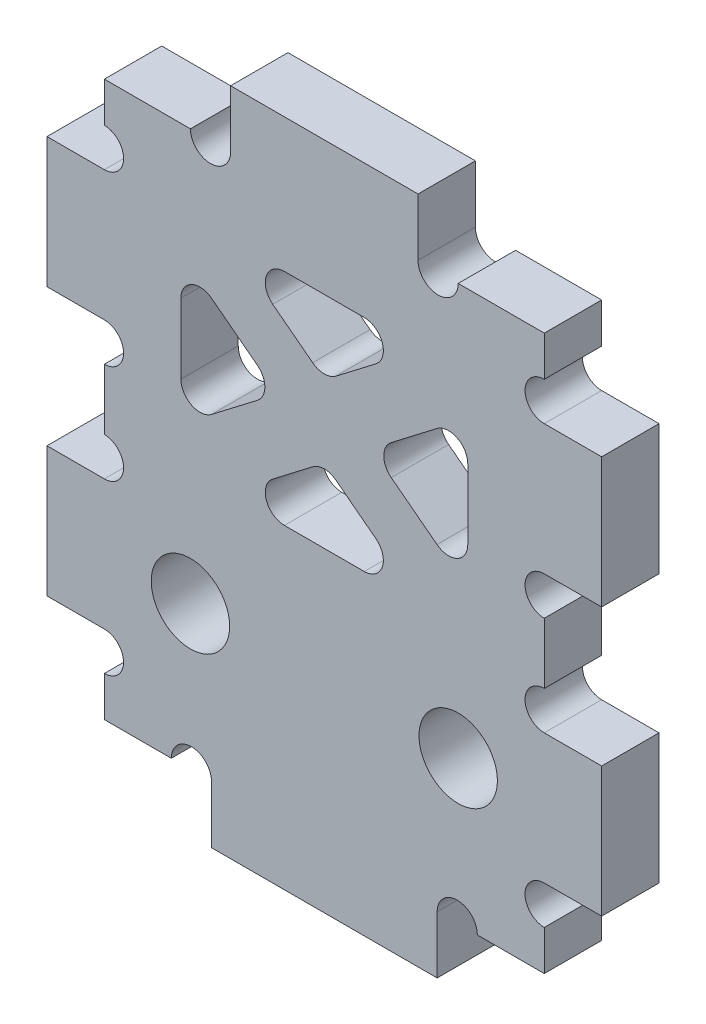
from build123d import *

# Parameters (mm, degrees)
SKETCH_1_R      = 2.05
EXTRUDE_1_DEPTH = 3
FILLET_1_R      = 1


with BuildPart() as part:
    # 草图1 → 凸台-拉伸1 (new body)
    with BuildSketch(Plane.XY):
        with BuildLine():
            Line((8, -14.5), (11.5, -14.5))
            Line((11.5, -14.5), (11.5, -12.41))
            ThreePointArc((11.5, -12.41), (10.495, -11.405), (11.5, -10.4))
            Line((11.5, -10.4), (14.5, -10.4))
            Line((14.5, -10.4), (14.5, -3.6))
            Line((14.5, -3.6), (11.5, -3.6))
            ThreePointArc((11.5, -3.6), (10.495, -2.595), (11.5, -1.59))
            Line((11.5, -1.59), (11.5, 1.59))
            ThreePointArc((11.5, 1.59), (10.495, 2.595), (11.5, 3.6))
            Line((11.5, 3.6), (14.5, 3.6))
            Line((14.5, 3.6), (14.5, 10.4))
            Line((14.5, 10.4), (11.5, 10.4))
            ThreePointArc((11.5, 10.4), (10.495, 11.405), (11.5, 12.41))
            Line((11.5, 12.41), (11.5, 14.5))
            Line((11.5, 14.5), (7, 14.5))
            ThreePointArc((7, 14.5), (5.95, 13.45), (4.9, 14.5))
            Line((4.9, 14.5), (4.9, 17.5))
            Line((4.9, 17.5), (-4.9, 17.5))
            Line((-4.9, 17.5), (-4.9, 14.5))
            ThreePointArc((-4.9, 14.5), (-5.95, 13.45), (-7, 14.5))
            Line((-7, 14.5), (-11.5, 14.5))
            Line((-11.5, 14.5), (-11.5, 12.41))
            ThreePointArc((-11.5, 12.41), (-10.789357685, 12.115642315), (-10.495, 11.405))
            ThreePointArc((-10.495, 11.405), (-10.789357685, 10.694357685), (-11.5, 10.4))
            Line((-11.5, 10.4), (-14.5, 10.4))
            Line((-14.5, 10.4), (-14.5, 3.6))
            Line((-14.5, 3.6), (-11.5, 3.6))
            ThreePointArc((-11.5, 3.6), (-10.789357685, 3.305642315), (-10.495, 2.595))
            ThreePointArc((-10.495, 2.595), (-10.789357685, 1.884357685), (-11.5, 1.59))
            Line((-11.5, 1.59), (-11.5, -1.59))
            ThreePointArc((-11.5, -1.59), (-10.789357685, -1.884357685), (-10.495, -2.595))
            ThreePointArc((-10.495, -2.595), (-10.789357685, -3.305642315), (-11.5, -3.6))
            Line((-11.5, -3.6), (-14.5, -3.6))
            Line((-14.5, -3.6), (-14.5, -10.4))
            Line((-14.5, -10.4), (-11.5, -10.4))
            ThreePointArc((-11.5, -10.4), (-10.789357685, -10.694357685), (-10.495, -11.405))
            ThreePointArc((-10.495, -11.405), (-10.789357685, -12.115642315), (-11.5, -12.41))
            Line((-11.5, -12.41), (-11.5, -14.5))
            Line((-11.5, -14.5), (-8, -14.5))
            ThreePointArc((-8, -14.5), (-6.95, -13.45), (-5.9, -14.5))
            Line((-5.9, -14.5), (-5.9, -17.5))
            Line((-5.9, -17.5), (5.9, -17.5))
            Line((5.9, -17.5), (5.9, -14.5))
            ThreePointArc((5.9, -14.5), (6.95, -13.45), (8, -14.5))
        make_face()
        with Locations((-7, -7)):
            Circle(SKETCH_1_R, mode=Mode.SUBTRACT)
        with Locations((7, -7)):
            Circle(SKETCH_1_R, mode=Mode.SUBTRACT)
        Polygon((-7.5, 0.890105817), (-7.5, 8.609894183), (-2.465355414, 4.75), align=None, mode=Mode.SUBTRACT)
        Polygon((5.034644586, -1), (-5.034644586, -1), (0, 2.859894183), align=None, mode=Mode.SUBTRACT)
        Polygon((-5.034644586, 10.5), (5.034644586, 10.5), (0, 6.640105817), align=None, mode=Mode.SUBTRACT)
        Polygon((2.465355414, 4.75), (7.5, 8.609894183), (7.5, 0.890105817), align=None, mode=Mode.SUBTRACT)
    extrude(amount=EXTRUDE_1_DEPTH)

    # 圆角1
    fillet_1_edges = [part.edges().sort_by_distance(p)[0] for p in [
        (5.034644586, -1, 1.5),
        (0, 2.859894183, 1.5),
        (-7.5, 8.609894183, 1.5),
        (-7.5, 0.890105817, 1.5),
        (-2.465355414, 4.75, 1.5),
        (0, 6.640105817, 1.5),
        (5.034644586, 10.5, 1.5),
        (-5.034644586, 10.5, 1.5),
        (7.5, 0.890105817, 1.5),
        (7.5, 8.609894183, 1.5),
        (2.465355414, 4.75, 1.5),
        (-5.034644586, -1, 1.5),
    ]]
    fillet(fillet_1_edges, radius=FILLET_1_R)


solid = part.part
